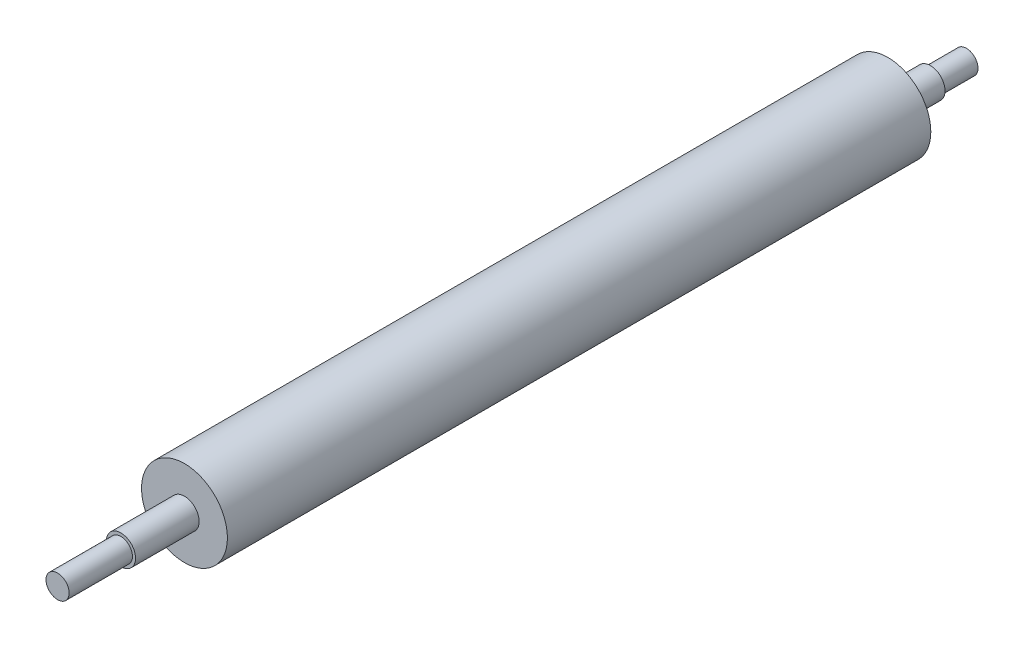
from build123d import *

# Parameters (mm, degrees)
SKETCH1_R           = 14.65
SKETCH1_R_2         = 5
SKETCH1_R_3         = 3.95
BOSS_EXTRUDE1_DEPTH = 240
SKETCH1_3_R         = 5
BOSS_EXTRUDE2_DEPTH = 14.5
BOSS_EXTRUDE3_START = -14.5
SKETCH1_4_R         = 3.95
BOSS_EXTRUDE3_DEPTH = 12.3
BOSS_EXTRUDE4_START = 261.7
SKETCH1_5_R         = 5
SKETCH1_5_R_2       = 3.95
BOSS_EXTRUDE4_DEPTH = 21.7
BOSS_EXTRUDE5_START = 283.3
SKETCH1_6_R         = 3.95
BOSS_EXTRUDE5_DEPTH = 21.6


with BuildPart() as part:
    # Sketch1 → Boss-Extrude1 (new body)
    # profile 1 of 3: a face of its own
    with BuildSketch(Plane.XY):
        Circle(SKETCH1_R)
        Circle(SKETCH1_R_2, mode=Mode.SUBTRACT)
    # profile 2 of 3: a face of its own
    with BuildSketch(Plane.XY):
        Circle(SKETCH1_R_2)
        Circle(SKETCH1_R_3, mode=Mode.SUBTRACT)
    # profile 3 of 3: a face of its own
    with BuildSketch(Plane.XY):
        Circle(SKETCH1_R_3)
    extrude(amount=BOSS_EXTRUDE1_DEPTH)

    # Sketch1<3> → Boss-Extrude2 (add)
    with BuildSketch(Plane.XY):
        Circle(SKETCH1_3_R)
    extrude(amount=-BOSS_EXTRUDE2_DEPTH)

    # Sketch1<4> → Boss-Extrude3 (add)
    with BuildSketch(Plane.XY.offset(BOSS_EXTRUDE3_START)):
        Circle(SKETCH1_4_R)
    extrude(amount=-BOSS_EXTRUDE3_DEPTH)

    # Sketch1<5> → Boss-Extrude4 (add)
    # profile 1 of 2: a face of its own
    with BuildSketch(Plane.XY.offset(BOSS_EXTRUDE4_START)):
        Circle(SKETCH1_5_R)
        Circle(SKETCH1_5_R_2, mode=Mode.SUBTRACT)
    # profile 2 of 2: a face of its own
    with BuildSketch(Plane.XY.offset(BOSS_EXTRUDE4_START)):
        Circle(SKETCH1_5_R_2)
    extrude(amount=-BOSS_EXTRUDE4_DEPTH)

    # Sketch1<6> → Boss-Extrude5 (add)
    with BuildSketch(Plane.XY.offset(BOSS_EXTRUDE5_START)):
        Circle(SKETCH1_6_R)
    extrude(amount=-BOSS_EXTRUDE5_DEPTH)


solid = part.part
